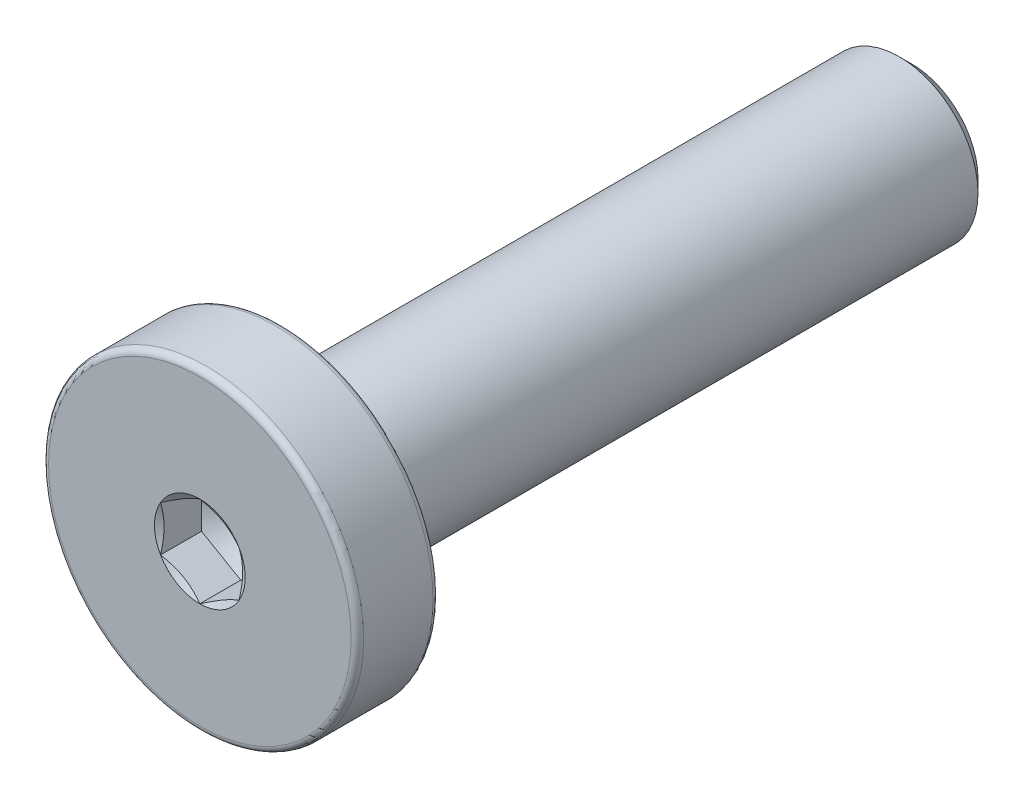
from build123d import *

# Parameters (mm, degrees)
CUT_EXTRUDE1_DEPTH = 0.65
FILLET1_R          = 0.1
CHAMFER1_SIZE      = 0.2


with BuildPart() as part:
    # Sketch2 → Revolve1 (revolve)
    with BuildSketch(Plane(origin=(0, 0, 0), x_dir=(0, 0, -1), z_dir=(1, 0, 0)), mode=Mode.PRIVATE) as revolve1_sk:
        Polygon((-1.3, 0), (-1.3, 2.5), (0, 2.5), (0, 1.25), (10, 1.25), (10, 0), align=None)
    revolve(revolve1_sk.sketch.rotate(Axis((0, 0, 1.3), (0, 0, -1)), 90), axis=Axis((0, 0, 1.3), (0, 0, -1)))

    # Sketch3 → Cut-Extrude1 (cut)
    with BuildSketch(Plane.XY.offset(1.3)):
        Polygon((0, 0.72), (-0.623538291, 0.36), (-0.623538291, -0.36), (0, -0.72), (0.623538291, -0.36), (0.623538291, 0.36), align=None)
    extrude(amount=-CUT_EXTRUDE1_DEPTH, mode=Mode.SUBTRACT)

    # Fillet1
    fillet1_edges = [part.edges().sort_by_distance(p)[0] for p in [
        (-2.5, 0, 0),
        (-2.5, 0, 1.3),
    ]]
    fillet(fillet1_edges, radius=FILLET1_R)

    # Chamfer1
    chamfer1_edges = [part.edges().sort_by_distance(p)[0] for p in [
        (-1.25, 0, -10),
    ]]
    chamfer(chamfer1_edges, length=CHAMFER1_SIZE)

    # Sketch4 → Cut-Revolve1 (revolve, cut)
    with BuildSketch(Plane(origin=(0, 0, 0), x_dir=(0, 0, -1), z_dir=(1, 0, 0)), mode=Mode.PRIVATE) as cut_revolve1_sk:
        Polygon((-0.65, 0.72), (-0.217380354, 0), (-0.65, 0), align=None)
        Polygon((-1.3, 0.72), (-1.3, 0.57), (-1.21339746, 0.57), align=None)
    revolve(cut_revolve1_sk.sketch.rotate(Axis((0, 0, 0), (0, 0, -1)), 270), axis=Axis((0, 0, 0), (0, 0, -1)), mode=Mode.SUBTRACT)


solid = part.part
